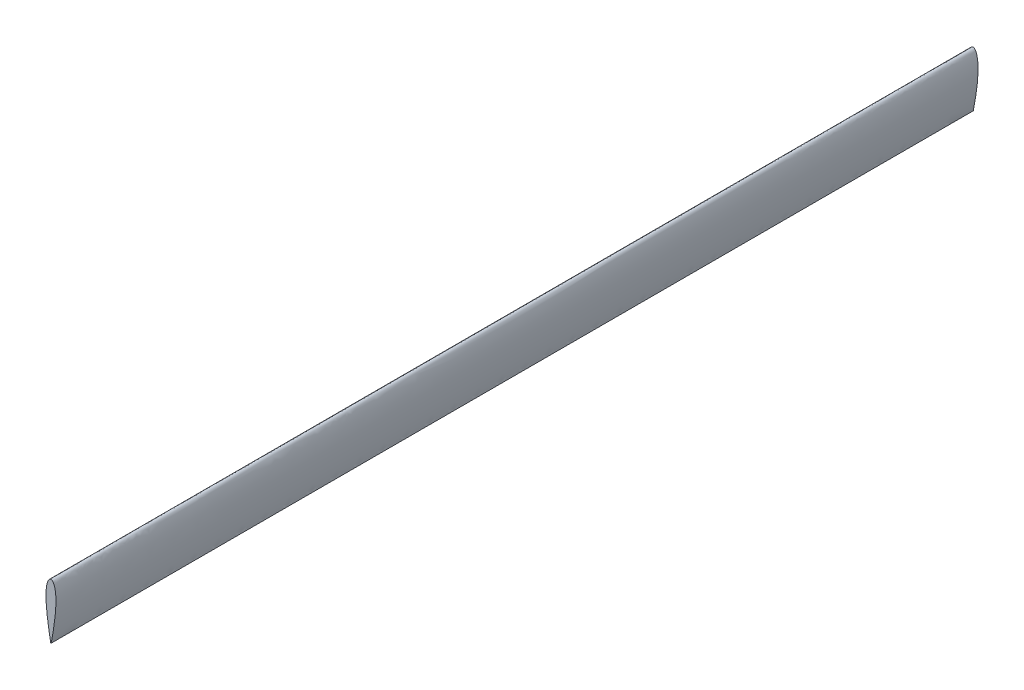
from build123d import *

# Parameters (mm, degrees)
BOSS_EXTRUDE1_DEPTH = 500


with BuildPart() as part:
    # Sketch1 → Boss-Extrude1 (new body)
    with BuildSketch(Plane.XY):
        with BuildLine():
            add(Edge.make_bspline(
                [(-67.487594852, -64.535319993), (-67.791340134, -64.535319992), (-68.395959064, -64.853444247), (-68.950850409, -65.69088519), (-69.405805811, -66.776801089), (-69.761060105, -68.164357657), (-70.016646281, -69.824697283), (-70.163160696, -71.72029666), (-70.198524461, -73.805578712), (-70.132809109, -76.029735468), (-69.978608842, -78.338463893), (-69.755518068, -80.675350139), (-69.482577671, -82.983195427), (-69.180120326, -85.205231207), (-68.864621673, -87.287729841), (-68.550147066, -89.175422065), (-68.266913852, -90.835293927), (-67.985738294, -92.186633061), (-67.834465648, -93.301954082), (-67.566792526, -93.908400036), (-67.664780593, -94.485267067), (-67.310407858, -94.485267732), (-67.408454432, -93.908390352), (-67.140190281, -93.302041198), (-66.992796391, -92.18608821), (-66.690504012, -90.838145873), (-66.510326339, -89.161281891), (-66.052324056, -87.297060826), (-65.946486906, -85.184052689), (-65.449510588, -82.990661168), (-65.231556197, -80.673560861), (-64.993430178, -78.338938244), (-64.843185417, -76.029614298), (-64.77646741, -73.805608496), (-64.812075666, -71.720289635), (-64.958532918, -69.824698864), (-65.214131838, -68.16435732), (-65.569383446, -66.776801156), (-66.024339378, -65.690885178), (-66.579230618, -64.853444249), (-67.18384957, -64.535319993), (-67.487594852, -64.535319993)],
                knots=[0, 0, 0, 0, 0.014808618, 0.029477235, 0.048226355, 0.07128013, 0.098404235, 0.129148048, 0.162903354, 0.198940156, 0.236430123, 0.274475787, 0.312143719, 0.348497572, 0.38263195, 0.413688921, 0.440887577, 0.463541539, 0.481065817, 0.493013516, 0.499065387, 0.500894221, 0.506946092, 0.518893791, 0.536418069, 0.559072031, 0.586272735, 0.61733747, 0.651455834, 0.687856281, 0.725524213, 0.763569877, 0.801059844, 0.837096646, 0.870851952, 0.901595765, 0.92871987, 0.951773645, 0.970522765, 0.985191382, 1, 1, 1, 1], degree=3))
        make_face()
    extrude(amount=BOSS_EXTRUDE1_DEPTH)


solid = part.part
